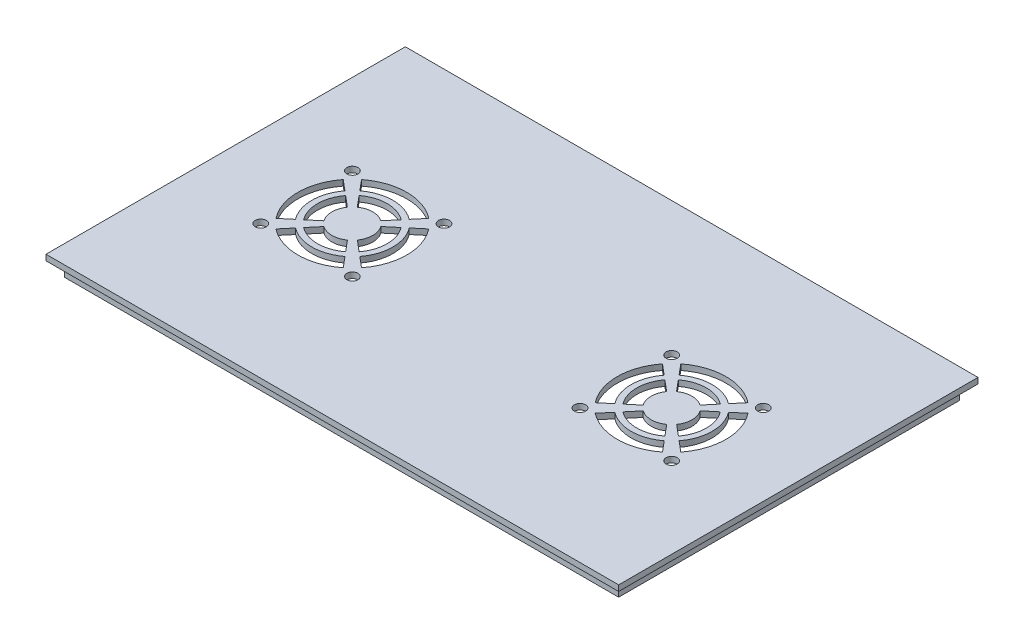
from build123d import *

# Parameters (mm, degrees)
SKETCH1_W              = 200
SKETCH1_H              = 125.5
BOSS_EXTRUDE1_DEPTH    = 2
SKETCH2_W              = 193.5
SKETCH2_H              = 119
BOSS_EXTRUDE2_DEPTH    = 5
SKETCH3_W              = 187.5
SKETCH3_H              = 113
CUT_EXTRUDE1_DEPTH     = 5
FILLET1_R              = 2
M3_5_CLEARANCE_HOLE1_D = 3.9
CUT_EXTRUDE3_DEPTH     = 2
LPATTERN1_COUNT        = 2
LPATTERN1_PITCH        = 111.5


with BuildPart() as part:
    # Sketch1 → Boss-Extrude1 (new body)
    with BuildSketch(Plane(origin=(0, 0, 0), x_dir=(1, 0, 0), z_dir=(0, 1, 0))):
        with Locations((11.680911681, -22.009259259)):
            Rectangle(SKETCH1_W, SKETCH1_H)
    extrude(amount=BOSS_EXTRUDE1_DEPTH)

    # Sketch2 → Boss-Extrude2 (add)
    with BuildSketch(Plane.XZ):
        with Locations((11.680911681, 22.009259259)):
            Rectangle(SKETCH2_W, SKETCH2_H)
    extrude(amount=BOSS_EXTRUDE2_DEPTH)

    # Sketch3 → Cut-Extrude1 (cut)
    with BuildSketch(Plane.XZ.offset(5)):
        with Locations((11.680911681, 22.009259259)):
            Rectangle(SKETCH3_W, SKETCH3_H)
    extrude(amount=-CUT_EXTRUDE1_DEPTH, mode=Mode.SUBTRACT)

    # Fillet1
    fillet1_edges = [part.edges().sort_by_distance(p)[0] for p in [
        (105.430911681, 0, 22.009259259),
        (11.680911681, 0, -34.490740741),
        (-82.069088319, 0, 22.009259259),
        (11.680911681, 0, 78.509259259),
    ]]
    fillet(fillet1_edges, radius=FILLET1_R)

    # M3.5 Clearance Hole1 (through all)
    with Locations(Plane(origin=(0, 2, 0), x_dir=(-1, 0, 0), z_dir=(0, 1, 0))):
        with Locations((60.069088319, 38.009259259), (28.069088319, 38.009259259), (28.069088319, 6.009259259), (60.069088319, 6.009259259), (-51.430911681, 38.009259259), (-51.430911681, 6.009259259), (-83.430911681, 6.009259259), (-83.430911681, 38.009259259)):
            Hole(M3_5_CLEARANCE_HOLE1_D / 2)

    # Sketch9 → Cut-Extrude3 (cut)
    with BuildSketch(Plane(origin=(0, 2, 0), x_dir=(1, 0, 0), z_dir=(0, 1, 0))):
        with BuildLine():
            Line((-59.006386494, -10.267150282), (-55.293048336, -13.388835035))
            ThreePointArc((-55.293048336, -13.388835035), (-58.221436969, -22.013724686), (-55.287606174, -30.636764657))
            Line((-55.287606174, -30.636764657), (-59.006386494, -33.751368237))
            ThreePointArc((-59.006386494, -33.751368237), (-63.069088319, -22.009259259), (-59.006386494, -10.267150282))
        make_face()
        with BuildLine():
            Line((-53.75963561, -14.677926123), (-49.910160311, -17.914057022))
            ThreePointArc((-49.910160311, -17.914057022), (-51.202718747, -22.020227048), (-49.897540172, -26.122403114))
            Line((-49.897540172, -26.122403114), (-53.752014553, -29.350655033))
            ThreePointArc((-53.752014553, -29.350655033), (-56.220430324, -22.015570701), (-53.75963561, -14.677926123))
        make_face()
        with BuildLine():
            Line((-52.696593717, -10.790741404), (-55.811197297, -7.071961085))
            ThreePointArc((-55.811197297, -7.071961085), (-44.069088319, -3.009259259), (-32.326979341, -7.071961085))
            Line((-32.326979341, -7.071961085), (-35.448664095, -10.785299243))
            ThreePointArc((-35.448664095, -10.785299243), (-44.073553746, -7.856910609), (-52.696593717, -10.790741404))
        make_face()
        with BuildLine():
            Line((-48.182232174, -16.180807406), (-51.410484093, -12.326333025))
            ThreePointArc((-51.410484093, -12.326333025), (-44.075399761, -9.857917254), (-36.737755183, -12.318711968))
            Line((-36.737755183, -12.318711968), (-39.973886082, -16.168187268))
            ThreePointArc((-39.973886082, -16.168187268), (-44.080056108, -14.875628831), (-48.182232174, -16.180807406))
        make_face()
        with BuildLine():
            Line((-32.850570464, -13.381753861), (-29.131790144, -10.267150282))
            ThreePointArc((-29.131790144, -10.267150282), (-25.069088319, -22.009259259), (-29.131790144, -33.751368237))
            Line((-29.131790144, -33.751368237), (-32.845128303, -30.629683483))
            ThreePointArc((-32.845128303, -30.629683483), (-29.916739669, -22.004793832), (-32.850570464, -13.381753861))
        make_face()
        with BuildLine():
            Line((-38.240636466, -17.896115404), (-34.386162085, -14.667863485))
            ThreePointArc((-34.386162085, -14.667863485), (-31.917746314, -22.002947817), (-34.378541028, -29.340592396))
            Line((-34.378541028, -29.340592396), (-38.228016328, -26.104461496))
            ThreePointArc((-38.228016328, -26.104461496), (-36.935457891, -21.998291471), (-38.240636466, -17.896115404))
        make_face()
        with BuildLine():
            Line((-35.441582921, -33.227777114), (-32.326979341, -36.946557434))
            ThreePointArc((-32.326979341, -36.946557434), (-44.069088319, -41.009259259), (-55.811197297, -36.946557434))
            Line((-55.811197297, -36.946557434), (-52.689512543, -33.233219276))
            ThreePointArc((-52.689512543, -33.233219276), (-44.064622892, -36.161607909), (-35.441582921, -33.227777114))
        make_face()
        with BuildLine():
            Line((-39.955944464, -27.837711112), (-36.727692545, -31.692185493))
            ThreePointArc((-36.727692545, -31.692185493), (-44.062776877, -34.160601264), (-51.400421455, -31.69980655))
            Line((-51.400421455, -31.69980655), (-48.164290556, -27.850331251))
            ThreePointArc((-48.164290556, -27.850331251), (-44.058120531, -29.142889687), (-39.955944464, -27.837711112))
        make_face()
    cut_extrude3 = extrude(amount=-CUT_EXTRUDE3_DEPTH, mode=Mode.SUBTRACT)

    # LPattern1: Cut-Extrude3 ×2
    with Locations(*[(i * LPATTERN1_PITCH, 0, 0) for i in range(1, LPATTERN1_COUNT)]):
        add(cut_extrude3, mode=Mode.SUBTRACT)


solid = part.part
